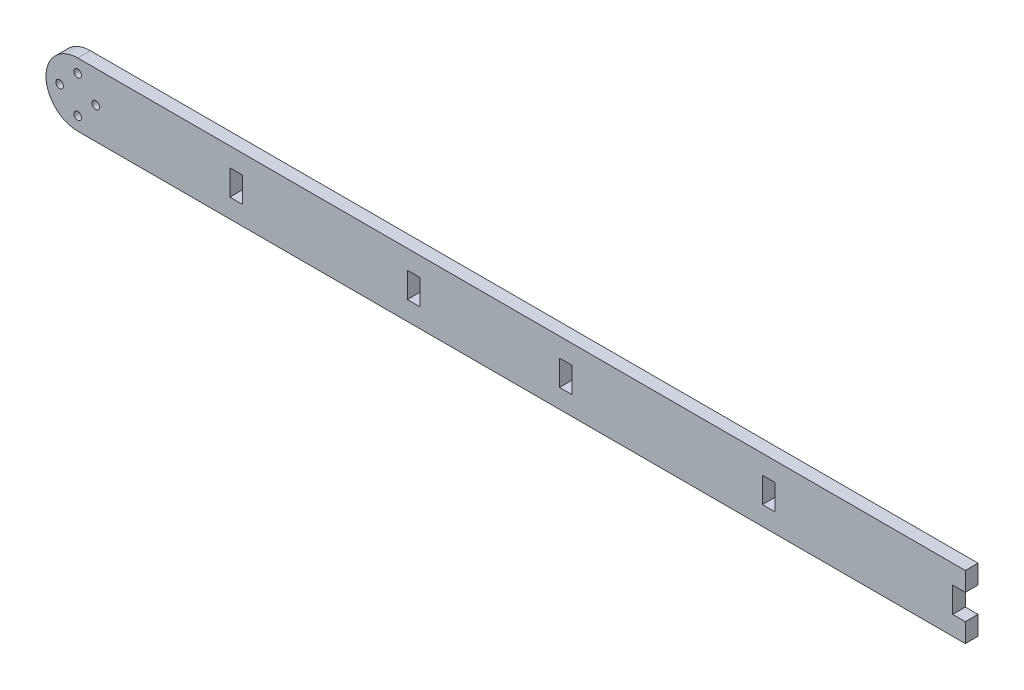
from build123d import *

# Parameters (mm, degrees)
SKETCH_1_R          = 1.5
EXTRUDE_1_DEPTH     = 5
SKETCH_3_W          = 5
SKETCH_3_H          = 10
CUT_EXTRUDE_1_DEPTH = 351.258832865


with BuildPart() as part:
    # 스케치1 → 보스-돌출1 (new body)
    with BuildSketch(Plane.XY):
        with BuildLine():
            Line((0, -12.5), (350, -12.5))
            Line((350, -12.5), (350, -5))
            Line((350, -5), (345, -5))
            Line((345, -5), (345, 5))
            Line((345, 5), (350, 5))
            Line((350, 5), (350, 12.5))
            Line((350, 12.5), (0, 12.5))
            ThreePointArc((0, 12.5), (-12.5, 0), (0, -12.5))
        make_face()
        with Locations((7.116257118, 0)):
            Circle(SKETCH_1_R, mode=Mode.SUBTRACT)
        with Locations((-7.116257118, 0)):
            Circle(SKETCH_1_R, mode=Mode.SUBTRACT)
        with Locations((0, 7.25)):
            Circle(SKETCH_1_R, mode=Mode.SUBTRACT)
        with Locations((0, -7.25)):
            Circle(SKETCH_1_R, mode=Mode.SUBTRACT)
    extrude(amount=EXTRUDE_1_DEPTH)

    # 스케치3 → 컷-돌출1 (cut, through all)
    with BuildSketch(Plane(origin=(0, 0, 0), x_dir=(-1, 0, 0), z_dir=(0, 0, -1))):
        with Locations((-272.5, 0)):
            Rectangle(SKETCH_3_W, SKETCH_3_H)
        with Locations((-192.5, 0)):
            Rectangle(SKETCH_3_W, SKETCH_3_H)
        with Locations((-132.5, 0)):
            Rectangle(SKETCH_3_W, SKETCH_3_H)
        with Locations((-62.5, 0)):
            Rectangle(SKETCH_3_W, SKETCH_3_H)
    extrude(amount=-CUT_EXTRUDE_1_DEPTH, mode=Mode.SUBTRACT)


solid = part.part
